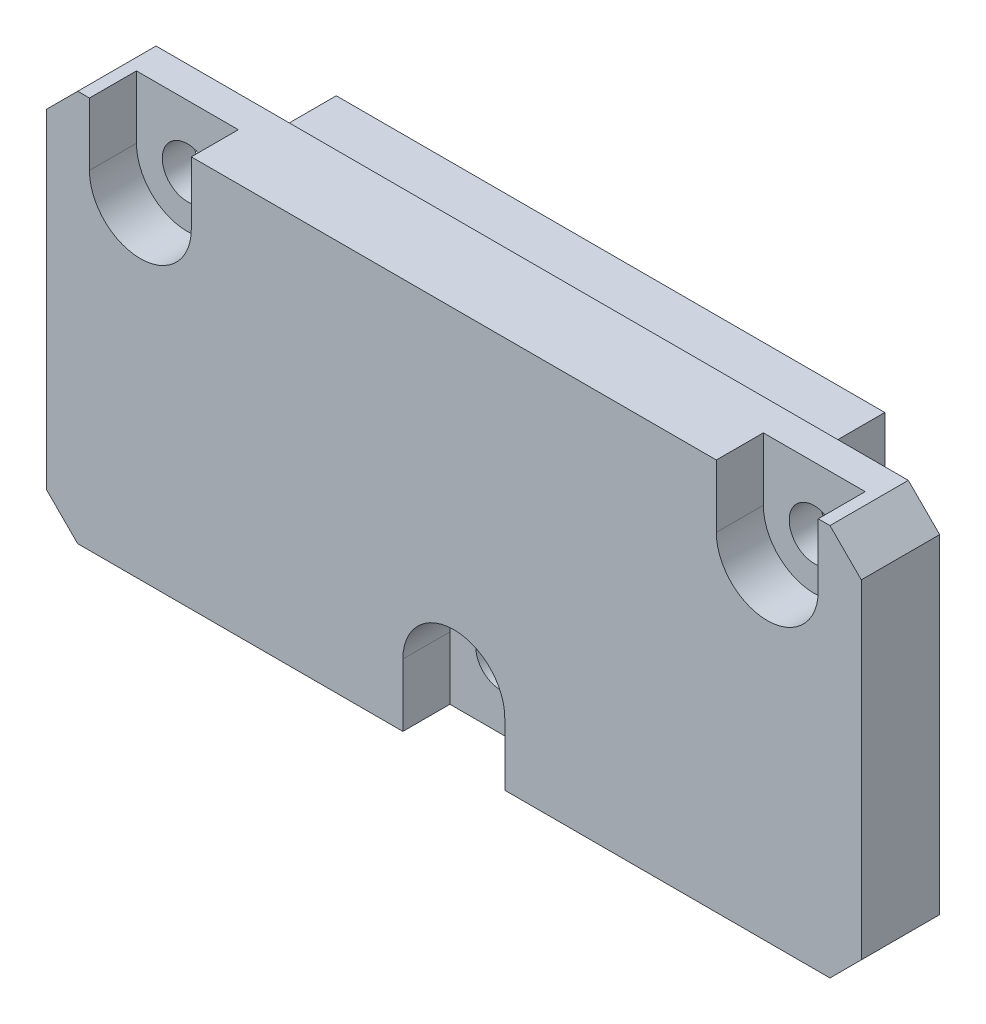
from build123d import *

# Parameters (mm, degrees)
SKETCH_1_W          = 52
SKETCH_1_H          = 25
EXTRUDE_1_DEPTH     = 5
CHAMFER_1_SIZE      = 2
SKETCH_2_W          = 35
SKETCH_2_H          = 15
EXTRUDE_2_DEPTH     = 5
SKETCH_3_R          = 3.25
CUT_EXTRUDE_1_DEPTH = 3
SKETCH_5_R          = 1.6
CUT_EXTRUDE_2_DEPTH = 30.685855218


with BuildPart() as part:
    # Эскиз1 → Бобышка-Вытянуть1 (new body)
    with BuildSketch(Plane.XY):
        Rectangle(SKETCH_1_W, SKETCH_1_H)
    extrude(amount=EXTRUDE_1_DEPTH)

    # Фаска1
    chamfer_1_edges = [part.edges().sort_by_distance(p)[0] for p in [
        (26, -12.5, 2.5),
        (-26, -12.5, 2.5),
        (-26, 12.5, 2.5),
        (26, 12.5, 2.5),
    ]]
    chamfer(chamfer_1_edges, length=CHAMFER_1_SIZE)

    # Эскиз2 → Бобышка-Вытянуть2 (add)
    with BuildSketch(Plane(origin=(0, 0, 0), x_dir=(-1, 0, 0), z_dir=(0, 0, -1))):
        with Locations((0, 3)):
            Rectangle(SKETCH_2_W, SKETCH_2_H)
    extrude(amount=EXTRUDE_2_DEPTH)

    # Эскиз3 → Вырез-Вытянуть1 (cut)
    with BuildSketch(Plane.XY.offset(5)):
        with Locations((0, -8.5)):
            Circle(SKETCH_3_R)
        with BuildLine():
            ThreePointArc((3.25, -8.5), (0, -11.75), (-3.25, -8.5))
            Line((-3.25, -8.5), (-3.25, -12.5))
            Line((-3.25, -12.5), (3.25, -12.5))
            Line((3.25, -12.5), (3.25, -8.5))
        make_face()
        with BuildLine():
            Line((-23.25, 12.5), (-23.25, 8.5))
            ThreePointArc((-23.25, 8.5), (-20, 11.75), (-16.75, 8.5))
            Line((-16.75, 8.5), (-16.75, 12.5))
            Line((-16.75, 12.5), (-23.25, 12.5))
        make_face()
        with Locations((-20, 8.5)):
            Circle(SKETCH_3_R)
        with Locations((20, 8.5)):
            Circle(SKETCH_3_R)
        with BuildLine():
            Line((23.25, 12.5), (16.75, 12.5))
            Line((16.75, 12.5), (16.75, 8.5))
            ThreePointArc((16.75, 8.5), (20, 11.75), (23.25, 8.5))
            Line((23.25, 8.5), (23.25, 12.5))
        make_face()
    extrude(amount=-CUT_EXTRUDE_1_DEPTH, mode=Mode.SUBTRACT)

    # Эскиз5 → Вырез-Вытянуть2 (cut, through all)
    with BuildSketch(Plane.XY.offset(2)):
        with Locations((0, -8.5)):
            Circle(SKETCH_5_R)
        with Locations((-20, 8.5)):
            Circle(SKETCH_5_R)
        with Locations((20, 8.5)):
            Circle(SKETCH_5_R)
    extrude(amount=-CUT_EXTRUDE_2_DEPTH, mode=Mode.SUBTRACT)


solid = part.part
